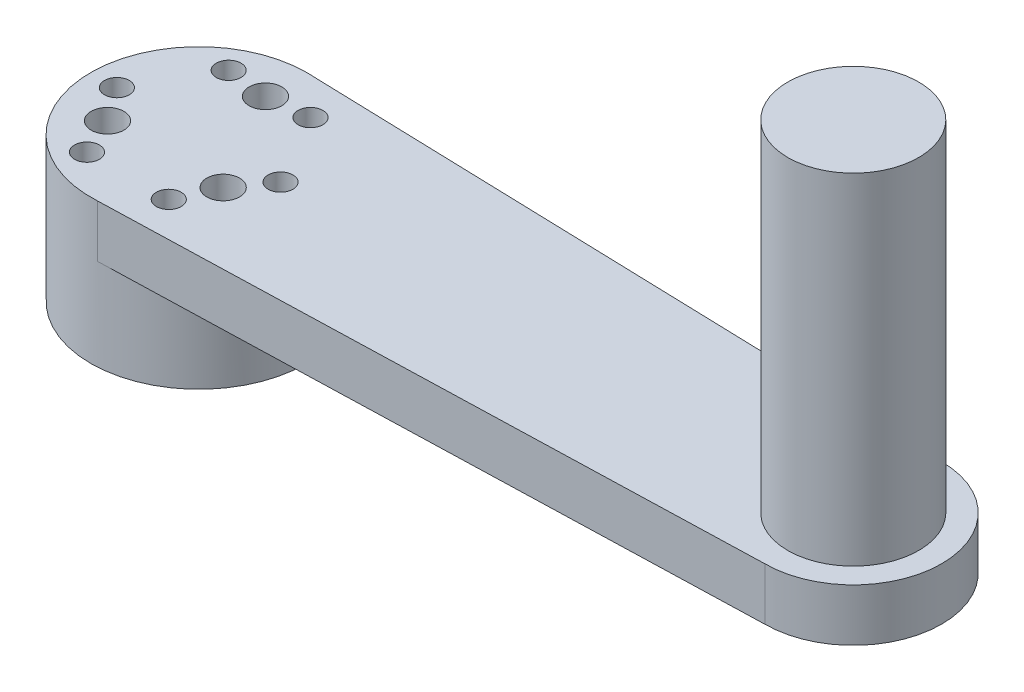
from build123d import *

# Parameters (mm, degrees)
SKETCH_1_R               = 16.5
EXTRUDE_1_DEPTH          = 8
CUT_EXTRUDE_1_DEPTH      = 25.667792767
CUT_EXTRUDE_1_DEPTH_BACK = 25.667792767
SKETCH_4_R               = 2.5
SKETCH_4_R_2             = 1.9
SKETCH_1_3_R             = 10
EXTRUDE_2_DEPTH          = 8
EXTRUDE_3_DEPTH          = 60
EXTRUDE_START            = 14
SKETCH_5_R               = 16.5
EXTRUDE_4_DEPTH          = 14
CUT_EXTRUDE_START        = -14
SKETCH_6_R               = 2.5
SKETCH_6_R_2             = 1.9
CUT_EXTRUDE_2_DEPTH      = 14


with BuildPart() as part:
    # 草图1 → 凸台-拉伸1 (new body)
    with BuildSketch(Plane(origin=(0, 0, 0), x_dir=(1, 0, 0), z_dir=(0, 1, 0))):
        Circle(SKETCH_1_R)
    extrude(amount=EXTRUDE_1_DEPTH)

    # 草图4 → 切除-拉伸1 (cut, two sides: drawn at the far end of the back side and taken through both)
    with BuildSketch(Plane(origin=(0, 8, 0), x_dir=(1, 0, 0), z_dir=(0, 1, 0)).offset(-CUT_EXTRUDE_1_DEPTH_BACK)):
        with Locations((0, 10.2)):
            Circle(SKETCH_4_R)
        with Locations((-6.25, 10.825317547)):
            Circle(SKETCH_4_R_2)
        with Locations((6.25, 10.825317547)):
            Circle(SKETCH_4_R_2)
        with Locations((12.5, 0)):
            Circle(SKETCH_4_R_2)
        with Locations((6.25, -10.825317547)):
            Circle(SKETCH_4_R_2)
        with Locations((-6.25, -10.825317547)):
            Circle(SKETCH_4_R_2)
        with Locations((-12.5, 0)):
            Circle(SKETCH_4_R_2)
        with Locations((8.833459119, -5.1)):
            Circle(SKETCH_4_R)
        with Locations((-8.833459119, -5.1)):
            Circle(SKETCH_4_R)
    extrude(amount=CUT_EXTRUDE_1_DEPTH + CUT_EXTRUDE_1_DEPTH_BACK, mode=Mode.SUBTRACT)

    # 草图1<3> → 凸台-拉伸2 (add)
    with BuildSketch(Plane(origin=(0, 0, 0), x_dir=(1, 0, 0), z_dir=(0, 1, 0))):
        with BuildLine():
            ThreePointArc((0.989109801, 16.470326706), (16.5, 0), (0.989109801, -16.470326706))
            Line((0.989109801, -16.470326706), (100, -13.5))
            ThreePointArc((100, -13.5), (113.5, 0), (100, 13.5))
            Line((100, 13.5), (0.989109801, 16.470326706))
        make_face()
        with Locations((100, 0)):
            Circle(SKETCH_1_3_R, mode=Mode.SUBTRACT)
    extrude(amount=EXTRUDE_2_DEPTH)

    # 草图1<4> → 凸台-拉伸3 (add)
    with BuildSketch(Plane(origin=(0, 0, 0), x_dir=(1, 0, 0), z_dir=(0, 1, 0))):
        with BuildLine():
            ThreePointArc((110, 0), (100, 10), (90, 0))
            ThreePointArc((90, 0), (100, -10), (110, 0))
        make_face()
    extrude(amount=EXTRUDE_3_DEPTH)

    # 草图5 → 凸台-拉伸4 (add)
    with BuildSketch(Plane.XZ.offset(EXTRUDE_START)):
        Circle(SKETCH_5_R)
    extrude(amount=-EXTRUDE_4_DEPTH)

    # 草图6 → 切除-拉伸2 (cut)
    with BuildSketch(Plane.XZ.offset(14).offset(CUT_EXTRUDE_START)):
        with Locations((-8.833459119, 5.1)):
            Circle(SKETCH_6_R)
        with Locations((-12.5, 0)):
            Circle(SKETCH_6_R_2)
        with Locations((-6.25, -10.825317547)):
            Circle(SKETCH_6_R_2)
        with Locations((0, -10.2)):
            Circle(SKETCH_6_R)
        with Locations((6.25, -10.825317547)):
            Circle(SKETCH_6_R_2)
        with Locations((12.5, 0)):
            Circle(SKETCH_6_R_2)
        with Locations((8.833459119, 5.1)):
            Circle(SKETCH_6_R)
        with Locations((6.25, 10.825317547)):
            Circle(SKETCH_6_R_2)
        with Locations((-6.25, 10.825317547)):
            Circle(SKETCH_6_R_2)
    extrude(amount=CUT_EXTRUDE_2_DEPTH, mode=Mode.SUBTRACT)


solid = part.part
